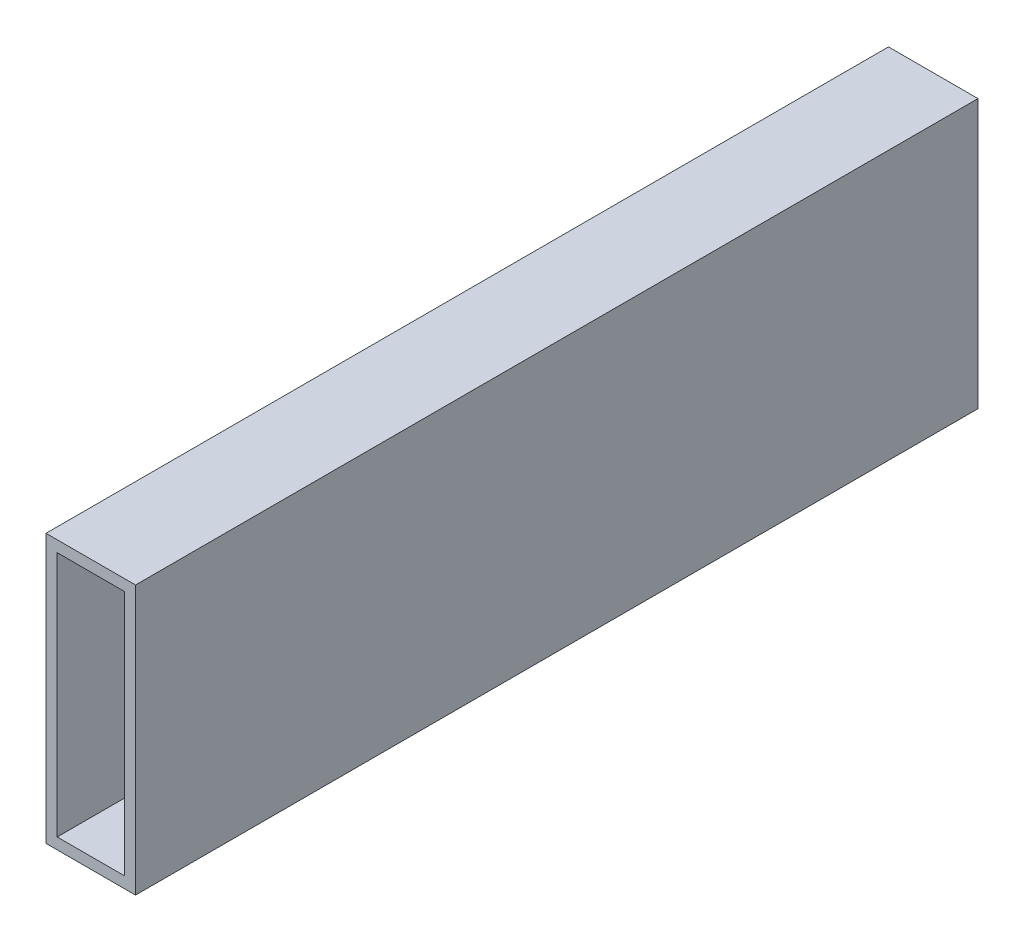
from build123d import *

# Parameters (mm, degrees)
SKETCH1_W           = 25.4
SKETCH1_H           = 76.2
SKETCH1_W_2         = 19.05
SKETCH1_H_2         = 69.85
BOSS_EXTRUDE1_DEPTH = 239.014


with BuildPart() as part:
    # Sketch1 → Boss-Extrude1 (new body)
    with BuildSketch(Plane.XY):
        Rectangle(SKETCH1_W, SKETCH1_H)
        Rectangle(SKETCH1_W_2, SKETCH1_H_2, mode=Mode.SUBTRACT)
    extrude(amount=BOSS_EXTRUDE1_DEPTH)


solid = part.part
